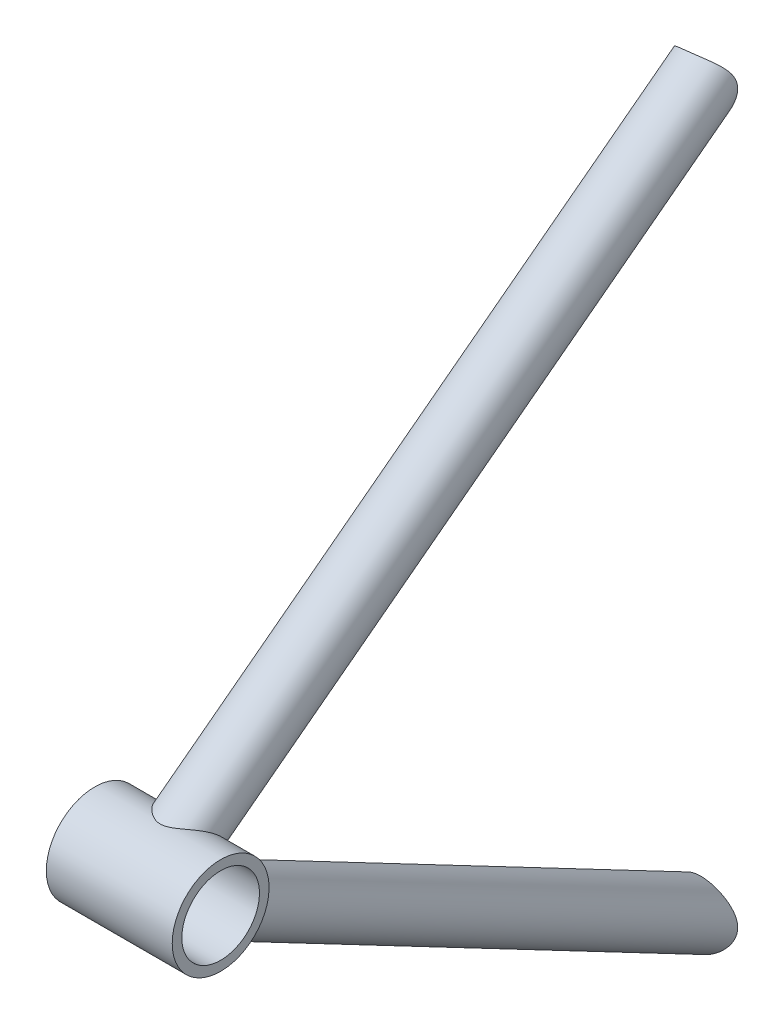
from build123d import *

# Parameters (mm, degrees)
SKETCH6_W                       = 41.275
SKETCH6_H                       = 3.1496
BOSS_EXTRUDE3_REACH             = 155.707
BOSS_EXTRUDE3_END_RADIUS        = 15.875
SKETCH7_R                       = 9.525
SKETCH7_R_2                     = 7.874
BOSS_EXTRUDE3_DIRECTION_2_DEPTH = 113.697907
BOSS_EXTRUDE4_REACH             = 239.965
BOSS_EXTRUDE4_END_RADIUS        = 15.875
SKETCH8_R                       = 9.525
SKETCH8_R_2                     = 7.874
BOSS_EXTRUDE4_DIRECTION_2_DEPTH = 113.697907
SKETCH5_R                       = 12.7


with BuildPart() as part:
    # Sketch6 → Revolve2 (revolve)
    with BuildSketch(Plane(origin=(0, 0, 0), x_dir=(1, 0, 0), z_dir=(0, 1, 0)), mode=Mode.PRIVATE) as revolve2_sk:
        with Locations((0, 14.3002)):
            Rectangle(SKETCH6_W, SKETCH6_H)
    revolve(revolve2_sk.sketch.rotate(Axis((-66.78681796, 0, 0), (1, 0, 0)), 180), axis=Axis((-66.78681796, 0, 0), (1, 0, 0)))


with BuildPart() as body_2:
    # Boss-Extrude3: up to this cylinder (the profile starts outside it)
    boss_extrude3_end = Plane(origin=(-10.298065, 0, 0), z_dir=(-1, 0, 0)) * Cylinder(BOSS_EXTRUDE3_END_RADIUS, 344.164, mode=Mode.PRIVATE)
    # Sketch7 → Boss-Extrude3 (new, up to the surface)
    with BuildSketch(Plane(origin=(-10.298064703, -67.630870949, -109.406671296), x_dir=(-0.5677718732695322, 0.7380955319549846, -0.36448605684181484), z_dir=(-0.09057391637954032, -0.496100169184832, -0.8635282206196003)), mode=Mode.PRIVATE) as boss_extrude3_sk1:
        with Locations(Location((0, 0, 0), (0, 0, 34.75825921))):
            Circle(SKETCH7_R)
        with Locations(Location((0, 0, 0), (0, 0, 34.75825921))):
            Circle(SKETCH7_R_2, mode=Mode.SUBTRACT)
    boss_extrude3_tool1 = extrude(boss_extrude3_sk1.sketch, amount=-BOSS_EXTRUDE3_REACH, mode=Mode.PRIVATE) - boss_extrude3_end
    add(boss_extrude3_tool1.solids().sort_by_distance((-10.298065, -75.656323, -104.796019))[0])

    # Sketch7 → Boss-Extrude3 direction 2 (add)
    with BuildSketch(Plane(origin=(-10.298064703, -67.630870949, -109.406671296), x_dir=(-0.5677718732695322, 0.7380955319549846, -0.36448605684181484), z_dir=(-0.09057391637954032, -0.496100169184832, -0.8635282206196003))):
        with Locations(Location((0, 0, 0), (0, 0, 34.75825921))):
            Circle(SKETCH7_R)
        with Locations(Location((0, 0, 0), (0, 0, 34.75825921))):
            Circle(SKETCH7_R_2, mode=Mode.SUBTRACT)
    extrude(amount=BOSS_EXTRUDE3_DIRECTION_2_DEPTH)


with BuildPart() as body_3:
    # Boss-Extrude4: up to this cylinder (the profile starts outside it)
    boss_extrude4_end = Plane(origin=(-10.298065, 0, 0), z_dir=(-1, 0, 0)) * Cylinder(BOSS_EXTRUDE4_END_RADIUS, 512.68, mode=Mode.PRIVATE)
    # Sketch8 → Boss-Extrude4 (new, up to the surface)
    with BuildSketch(Plane(origin=(-10.298064703, 67.630870949, -109.406671296), x_dir=(-0.9336956723978411, -0.343921706944635, -0.09965064394088002), z_dir=(-0.09057391637954033, 0.4961001691848235, -0.8635282206196053)), mode=Mode.PRIVATE) as boss_extrude4_sk1:
        with Locations(Location((0, 0, 0), (0, 0, 110.356024642))):
            Circle(SKETCH8_R)
        with Locations(Location((0, 0, 0), (0, 0, 110.356024642))):
            Circle(SKETCH8_R_2, mode=Mode.SUBTRACT)
    boss_extrude4_tool1 = extrude(boss_extrude4_sk1.sketch, amount=-BOSS_EXTRUDE4_REACH, mode=Mode.PRIVATE) - boss_extrude4_end
    add(boss_extrude4_tool1.solids().sort_by_distance((-10.298065, 59.605419, -114.017323))[0])

    # Sketch8 → Boss-Extrude4 direction 2 (add)
    with BuildSketch(Plane(origin=(-10.298064703, 67.630870949, -109.406671296), x_dir=(-0.9336956723978411, -0.343921706944635, -0.09965064394088002), z_dir=(-0.09057391637954033, 0.4961001691848235, -0.8635282206196053))):
        with Locations(Location((0, 0, 0), (0, 0, 110.356024642))):
            Circle(SKETCH8_R)
        with Locations(Location((0, 0, 0), (0, 0, 110.356024642))):
            Circle(SKETCH8_R_2, mode=Mode.SUBTRACT)
    extrude(amount=BOSS_EXTRUDE4_DIRECTION_2_DEPTH)


with BuildPart() as cut_sweep1_tool:
    # Cut-Sweep1: sweep along a path in Sketch4
    with BuildLine(Plane(origin=(-89.807251208, 0, -36.284484758), x_dir=(0.3746065934159061, 0, -0.92718385456679), z_dir=(0.92718385456679, 1.7211018129619384e-15, 0.3746065934159061))) as cut_sweep1_path:
        Line((182.017895706, -149.288318914), (197.170540677, -9.5862243))
        ThreePointArc((197.170540677, -9.5862243), (197.688900594, 0), (197.170540677, 9.5862243))
        Line((197.170540677, 9.5862243), (182.017895706, 149.288318914))
    # Sketch5 → Cut-Sweep1 (sweep)
    with BuildSketch(Plane(origin=(0, 0, 0), x_dir=(1, 0, 0), z_dir=(0, 1, 0))):
        with Locations((-15.7516856, 219.578441616)):
            Circle(SKETCH5_R)
    sweep(path=cut_sweep1_path.line)


with BuildPart() as body_2_1:
    add(body_2.part)

    # Cut-Sweep1: cut by cut_sweep1_tool
    add(cut_sweep1_tool.part, mode=Mode.SUBTRACT)


with BuildPart() as body_3_1:
    add(body_3.part)

    # Cut-Sweep1: cut by cut_sweep1_tool
    add(cut_sweep1_tool.part, mode=Mode.SUBTRACT)


solid = Compound([part.part, body_2_1.part, body_3_1.part])
